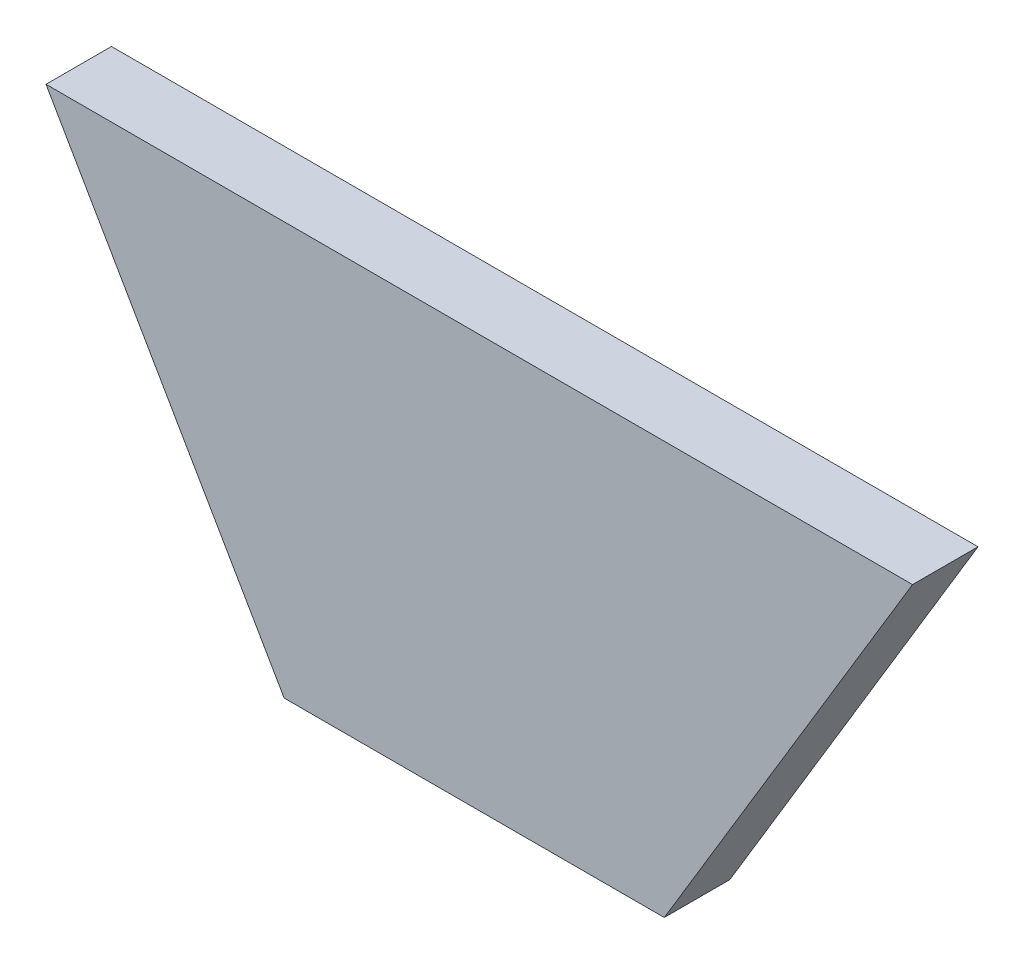
from build123d import *

# Parameters (mm, degrees)
BOSS_EXTRUDE1_DEPTH = 4
SKETCH6_R           = 1.75
CUT_EXTRUDE1_DEPTH  = 5


with BuildPart() as part:
    # Sketch5 → Boss-Extrude1 (new, symmetric)
    with BuildSketch(Plane.XY):
        Polygon((-52.571031757, -370.671309458), (53.31747051, -370.671309458), (22.981500363, -421.073600557), (-23.471255423, -421.073600557), align=None)
    extrude(amount=BOSS_EXTRUDE1_DEPTH, both=True)

    # Sketch6 → Cut-Extrude1 (cut)
    with BuildSketch(Plane.XZ.offset(421.073600557)):
        with Locations(Location((0, 0, 0), (0, 0, 270))):
            Circle(SKETCH6_R)
    extrude(amount=-CUT_EXTRUDE1_DEPTH, mode=Mode.SUBTRACT)


solid = part.part
